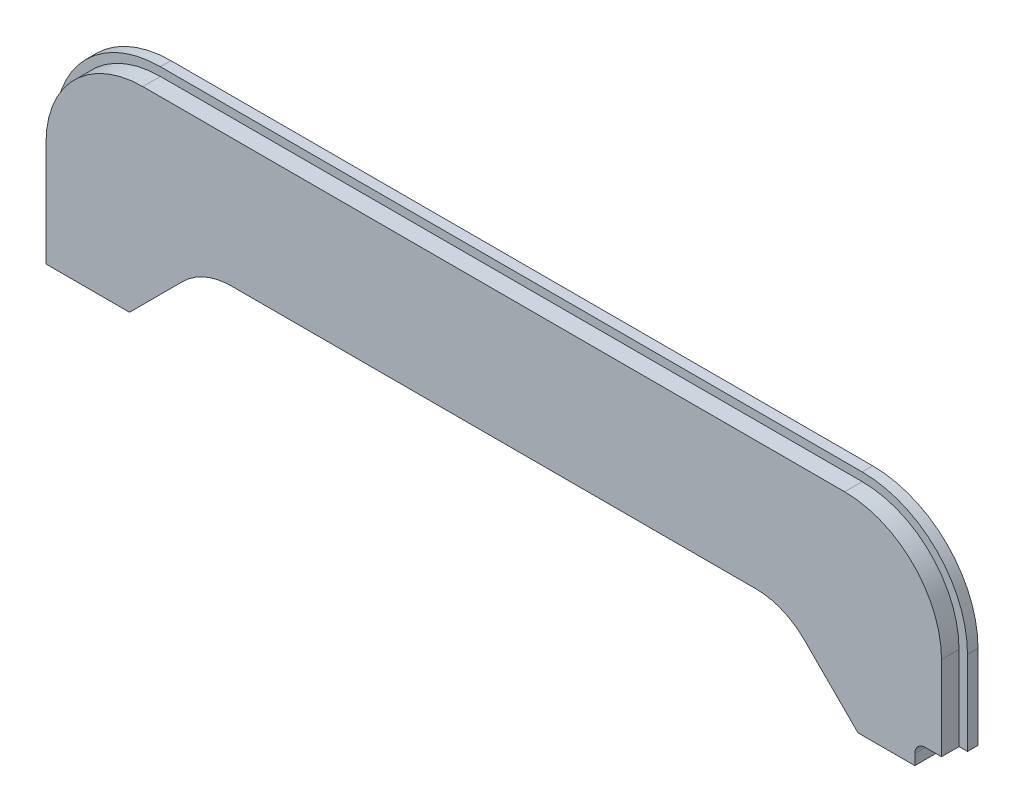
from build123d import *

# Parameters (mm, degrees)
BOSS_EXTRUDE1_DEPTH = 1.016
CUT_EXTRUDE1_START  = -0.635
CUT_EXTRUDE1_DEPTH  = 0.635
CUT_EXTRUDE2_DEPTH  = 19.211994839
CUT_EXTRUDE3_DEPTH  = 19.211994839


with BuildPart() as part:
    # Sketch1 → Boss-Extrude1 (new body)
    with BuildSketch(Plane.XY):
        with BuildLine():
            Line((-12.7, 7.62), (12.7, 7.62))
            ThreePointArc((12.7, 7.62), (15.394076836, 6.504076836), (16.51, 3.81))
            Line((16.51, 3.81), (16.51, 0))
            Line((16.51, 0), (-16.51, 0))
            Line((-16.51, 0), (-16.51, 3.81))
            ThreePointArc((-16.51, 3.81), (-15.394076836, 6.504076836), (-12.7, 7.62))
        make_face()
    extrude(amount=BOSS_EXTRUDE1_DEPTH)

    # Sketch2 → Cut-Extrude1 (cut)
    with BuildSketch(Plane.XY.offset(1.016).offset(CUT_EXTRUDE1_START)):
        with BuildLine():
            Line((16.2052, 0), (16.51, 0))
            Line((16.51, 0), (16.51, 3.81))
            ThreePointArc((16.51, 3.81), (15.394076836, 6.504076836), (12.7, 7.62))
            Line((12.7, 7.62), (-12.7, 7.62))
            ThreePointArc((-12.7, 7.62), (-15.394076836, 6.504076836), (-16.51, 3.81))
            Line((-16.51, 3.81), (-16.51, 0))
            Line((-16.51, 0), (-16.2052, 0))
            Line((-16.2052, 0), (-16.2052, 3.81))
            ThreePointArc((-16.2052, 3.81), (-15.178550689, 6.288550689), (-12.7, 7.3152))
            Line((-12.7, 7.3152), (12.7, 7.3152))
            ThreePointArc((12.7, 7.3152), (15.178550689, 6.288550689), (16.2052, 3.81))
            Line((16.2052, 3.81), (16.2052, 0))
        make_face()
    extrude(amount=CUT_EXTRUDE1_DEPTH, mode=Mode.SUBTRACT)

    # Sketch3 → Cut-Extrude2 (cut, through all)
    with BuildSketch(Plane.XY.offset(1.016)):
        with BuildLine():
            Line((-13.1826, 0), (-11.2446698, 1.9379302))
            ThreePointArc((-11.2446698, 1.9379302), (-10.4371152, 2.477520932), (-9.484539601, 2.667))
            Line((-9.484539601, 2.667), (9.484539601, 2.667))
            ThreePointArc((9.484539601, 2.667), (10.4371152, 2.477520932), (11.2446698, 1.9379302))
            Line((11.2446698, 1.9379302), (13.1826, 0))
            Line((13.1826, 0), (-13.1826, 0))
        make_face()
    extrude(amount=-CUT_EXTRUDE2_DEPTH, mode=Mode.SUBTRACT)

    # Sketch4 → Cut-Extrude3 (cut, through all)
    with BuildSketch(Plane.XY.offset(1.016)):
        with BuildLine():
            Line((16.51, 0), (15.24, 0))
            Line((15.24, 0), (15.24, 0.381))
            ThreePointArc((15.24, 0.381), (15.351592316, 0.650407684), (15.621, 0.762))
            Line((15.621, 0.762), (16.51, 0.762))
            Line((16.51, 0.762), (16.51, 0))
        make_face()
    extrude(amount=-CUT_EXTRUDE3_DEPTH, mode=Mode.SUBTRACT)


solid = part.part
